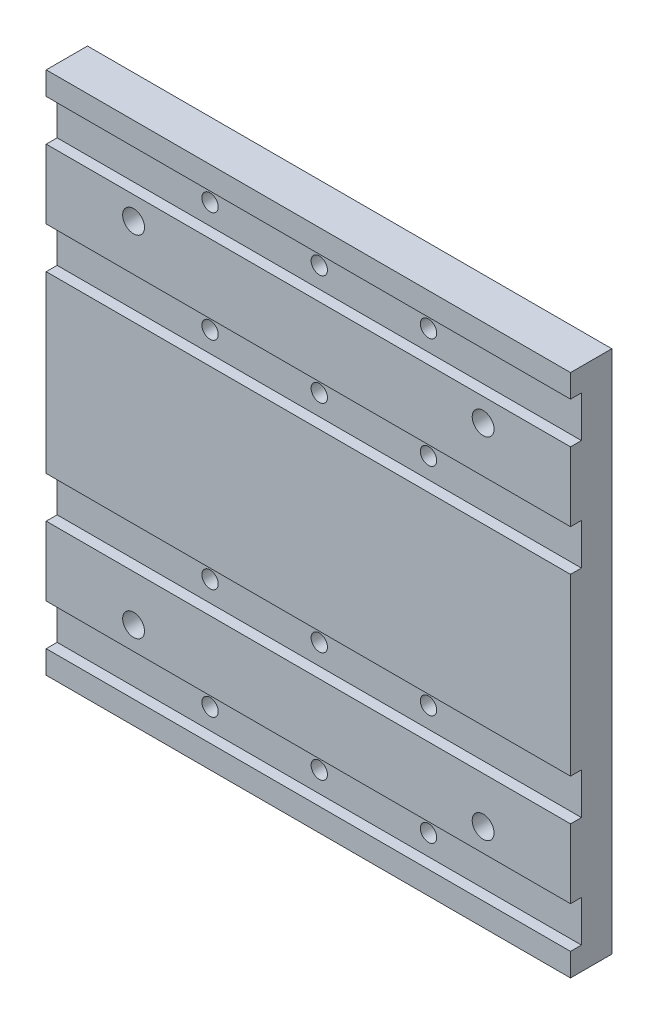
from build123d import *

# Parameters (mm, degrees)
SKETCH1_W           = 152.4
SKETCH1_H           = 152.4
SKETCH1_R           = 3.175
BOSS_EXTRUDE1_DEPTH = 12
SKETCH2_W           = 152.4
SKETCH2_H           = 12
SKETCH2_R           = 2.38125
CUT_EXTRUDE1_DEPTH  = 3.175
SKETCH3_R           = 2.38125
CUT_EXTRUDE2_DEPTH  = 109.429147373
SKETCH5_R           = 3.96875
CUT_EXTRUDE7_DEPTH  = 5.08


with BuildPart() as part:
    # Sketch1 → Boss-Extrude1 (new body)
    with BuildSketch(Plane.XY):
        Rectangle(SKETCH1_W, SKETCH1_H)
        with Locations((-50.8, 50.8)):
            Circle(SKETCH1_R, mode=Mode.SUBTRACT)
        with Locations((-50.8, -50.8)):
            Circle(SKETCH1_R, mode=Mode.SUBTRACT)
        with Locations((50.8, 50.8)):
            Circle(SKETCH1_R, mode=Mode.SUBTRACT)
        with Locations((50.8, -50.8)):
            Circle(SKETCH1_R, mode=Mode.SUBTRACT)
    extrude(amount=BOSS_EXTRUDE1_DEPTH)

    # Sketch2 → Cut-Extrude1 (cut)
    # profile 1 of 4: a face of its own
    with BuildSketch(Plane.XY.offset(12)):
        with Locations((0, -31.4)):
            Rectangle(SKETCH2_W, SKETCH2_H)
        with Locations((0, -31.4)):
            Circle(SKETCH2_R, mode=Mode.SUBTRACT)
        with Locations((-31.75, -31.4)):
            Circle(SKETCH2_R, mode=Mode.SUBTRACT)
        with Locations((31.75, -31.4)):
            Circle(SKETCH2_R, mode=Mode.SUBTRACT)
    # profile 2 of 4: a face of its own
    with BuildSketch(Plane.XY.offset(12)):
        with Locations((0, 31.4)):
            Rectangle(SKETCH2_W, SKETCH2_H)
        with Locations((0, 31.4)):
            Circle(SKETCH2_R, mode=Mode.SUBTRACT)
        with Locations((31.75, 31.4)):
            Circle(SKETCH2_R, mode=Mode.SUBTRACT)
        with Locations((-31.75, 31.4)):
            Circle(SKETCH2_R, mode=Mode.SUBTRACT)
    # profile 3 of 4: a face of its own
    with BuildSketch(Plane.XY.offset(12)):
        with Locations((0, 63.5)):
            Rectangle(SKETCH2_W, SKETCH2_H)
        with Locations((-31.75, 63.5)):
            Circle(SKETCH2_R, mode=Mode.SUBTRACT)
        with Locations((0, 63.5)):
            Circle(SKETCH2_R, mode=Mode.SUBTRACT)
        with Locations((31.75, 63.5)):
            Circle(SKETCH2_R, mode=Mode.SUBTRACT)
    # profile 4 of 4: a face of its own
    with BuildSketch(Plane.XY.offset(12)):
        with Locations((0, -63.5)):
            Rectangle(SKETCH2_W, SKETCH2_H)
        with Locations((0, -63.5)):
            Circle(SKETCH2_R, mode=Mode.SUBTRACT)
        with Locations((-31.75, -63.5)):
            Circle(SKETCH2_R, mode=Mode.SUBTRACT)
        with Locations((31.75, -63.5)):
            Circle(SKETCH2_R, mode=Mode.SUBTRACT)
    extrude(amount=-CUT_EXTRUDE1_DEPTH, mode=Mode.SUBTRACT)

    # Sketch3 → Cut-Extrude2 (cut, through all)
    with BuildSketch(Plane.XY.offset(12)):
        with Locations((-31.75, 63.5)):
            Circle(SKETCH3_R)
        with Locations((0, 63.5)):
            Circle(SKETCH3_R)
        with Locations((31.75, 63.5)):
            Circle(SKETCH3_R)
        with Locations((-31.75, 31.4)):
            Circle(SKETCH3_R)
        with Locations((0, 31.4)):
            Circle(SKETCH3_R)
        with Locations((31.75, 31.4)):
            Circle(SKETCH3_R)
        with Locations((-31.75, -31.4)):
            Circle(SKETCH3_R)
        with Locations((0, -31.4)):
            Circle(SKETCH3_R)
        with Locations((31.75, -31.4)):
            Circle(SKETCH3_R)
        with Locations((-31.75, -63.5)):
            Circle(SKETCH3_R)
        with Locations((0, -63.5)):
            Circle(SKETCH3_R)
        with Locations((31.75, -63.5)):
            Circle(SKETCH3_R)
    extrude(amount=-CUT_EXTRUDE2_DEPTH, mode=Mode.SUBTRACT)

    # Sketch5 → Cut-Extrude7 (cut)
    with BuildSketch(Plane(origin=(0, 0, 0), x_dir=(-1, 0, 0), z_dir=(0, 0, -1))):
        with Locations((31.75, -63.5)):
            Circle(SKETCH5_R)
        with Locations((0, -63.5)):
            Circle(SKETCH5_R)
        with Locations((-31.75, -63.5)):
            Circle(SKETCH5_R)
        with Locations((-31.75, -31.4)):
            Circle(SKETCH5_R)
        with Locations((0, -31.4)):
            Circle(SKETCH5_R)
        with Locations((31.75, -31.4)):
            Circle(SKETCH5_R)
        with Locations((31.75, 31.4)):
            Circle(SKETCH5_R)
        with Locations((0, 31.4)):
            Circle(SKETCH5_R)
        with Locations((-31.75, 31.4)):
            Circle(SKETCH5_R)
        with Locations((-31.75, 63.5)):
            Circle(SKETCH5_R)
        with Locations((0, 63.5)):
            Circle(SKETCH5_R)
        with Locations((31.75, 63.5)):
            Circle(SKETCH5_R)
    extrude(amount=-CUT_EXTRUDE7_DEPTH, mode=Mode.SUBTRACT)


solid = part.part
